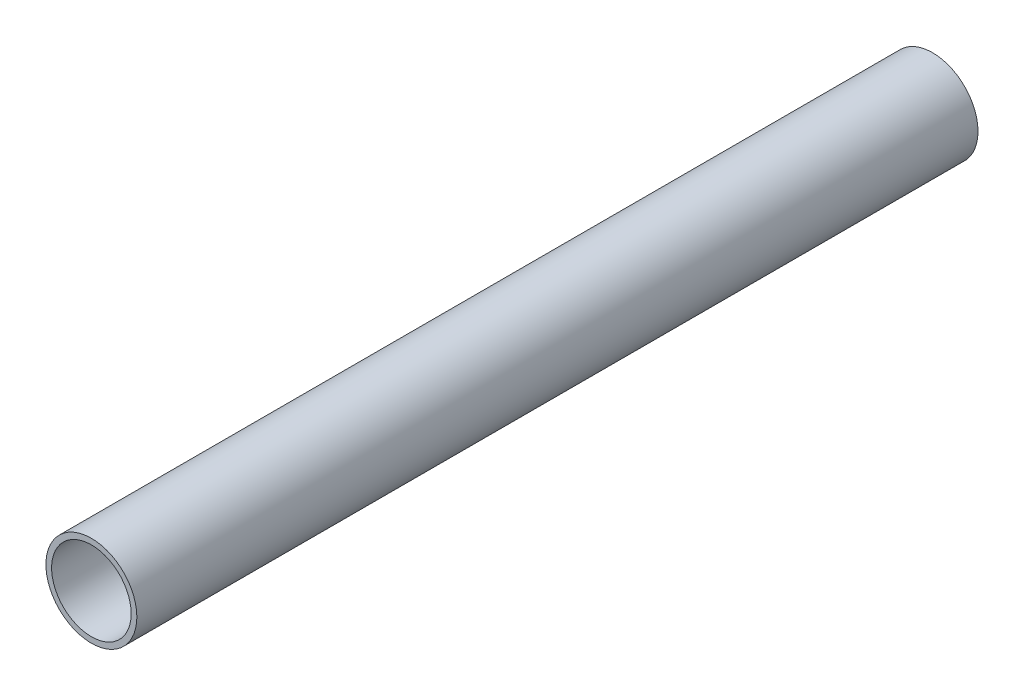
from build123d import *

# Parameters (mm, degrees)
SKETCH1_R           = 2
BOSS_EXTRUDE1_DEPTH = 18.5
SKETCH2_R           = 1.75
CUT_EXTRUDE1_DEPTH  = 38.107950631


with BuildPart() as part:
    # Sketch1 → Boss-Extrude1 (new, symmetric)
    with BuildSketch(Plane.XY):
        Circle(SKETCH1_R)
    extrude(amount=BOSS_EXTRUDE1_DEPTH, both=True)

    # Sketch2 → Cut-Extrude1 (cut, through all)
    with BuildSketch(Plane.XY.offset(18.5)):
        Circle(SKETCH2_R)
    extrude(amount=-CUT_EXTRUDE1_DEPTH, mode=Mode.SUBTRACT)


solid = part.part
